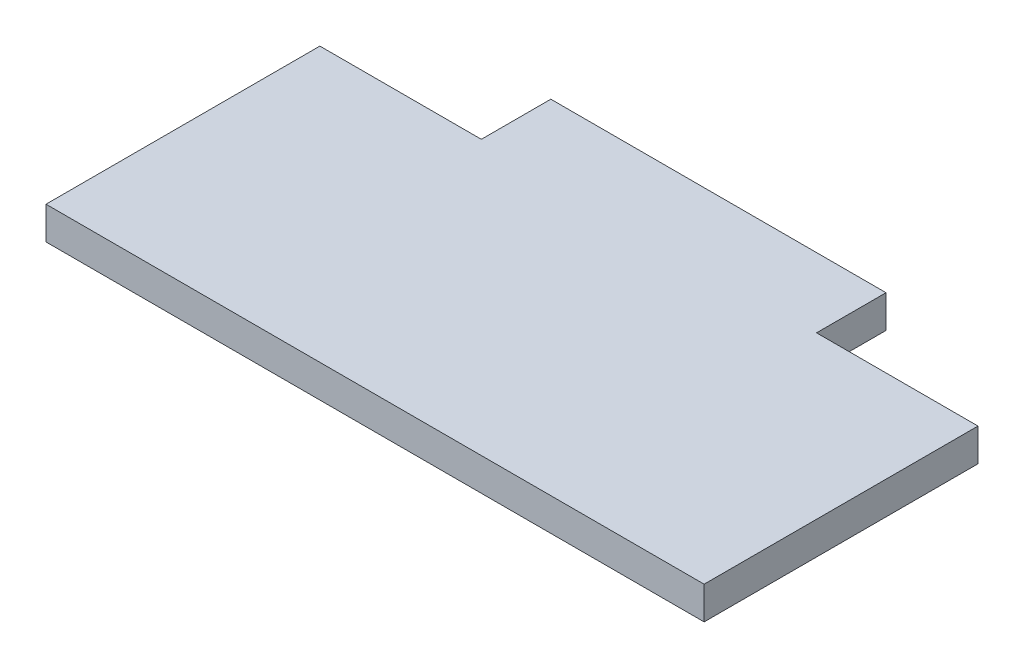
from build123d import *

# Parameters (mm, degrees)
BOSS_EXTRUDE1_DEPTH = 12.7


with BuildPart() as part:
    # Sketch1 → Boss-Extrude1 (new body)
    with BuildSketch(Plane(origin=(0, 0, 0), x_dir=(1, 0, 0), z_dir=(0, 1, 0))):
        Polygon((-65.0875, 0), (-65.0875, 26.9875), (65.0875, 26.9875), (65.0875, 0), (127.79375, 0), (127.79375, -106.3625), (-127.79375, -106.3625), (-127.79375, 0), align=None)
    extrude(amount=BOSS_EXTRUDE1_DEPTH)


solid = part.part
